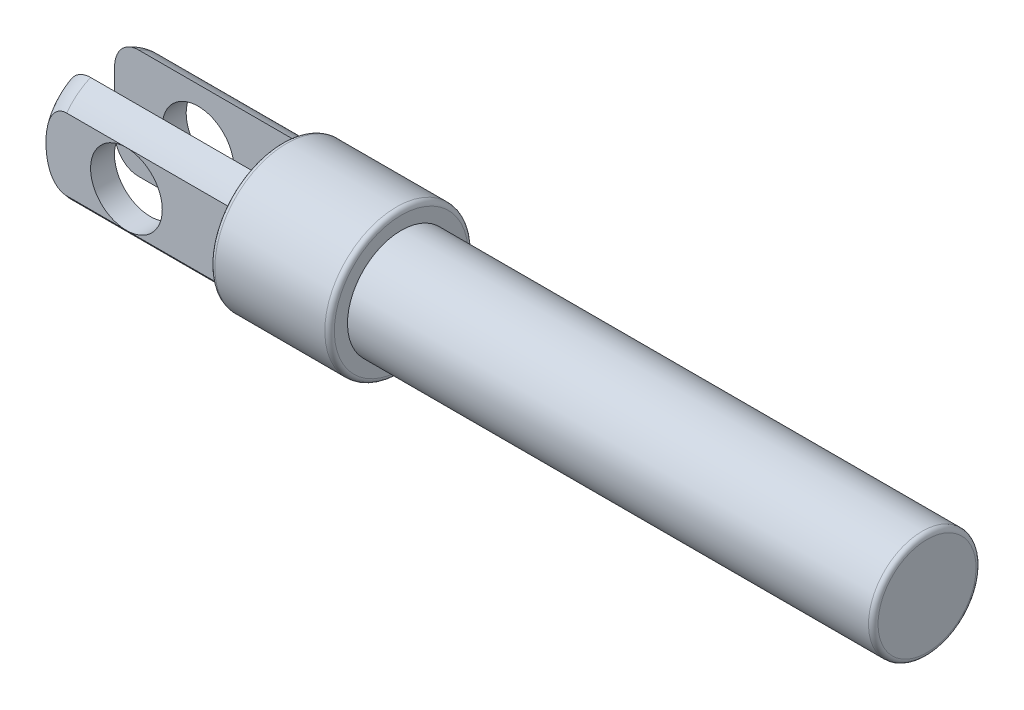
from build123d import *

# Parameters (mm, degrees)
FILLET_1_R               = 1
SKETCH_2_R               = 7.321356554
SKETCH_2_W               = 1
SKETCH_2_H               = 8.939101976
SKETCH_2_H_2             = 8.847887315
CUT_EXTRUDE_1_DEPTH      = 8
FILLET_2_R               = 0.2
CUT_EXTRUDE_2_DEPTH      = 36.355339178
CUT_EXTRUDE_2_DEPTH_BACK = 36.355339178
SKETCH_3_R               = 1.5


with BuildPart() as part:
    # 草图1 → 旋转1 (revolve)
    with BuildSketch(Plane.XY):
        Polygon((0, 0), (0, 2.25), (-22, 2.25), (-22, 3), (-27, 3), (-27, 2.5), (-35, 2.5), (-35, 0), align=None)
    revolve(axis=Axis((0, 0, 0), (-1, 0, 0)))

    # 圆角1
    fillet_1_edges = [part.edges().sort_by_distance(p)[0] for p in [
        (-35, -2.5, 0),
    ]]
    fillet(fillet_1_edges, radius=FILLET_1_R)

    # 草图2 → 切除-拉伸1 (cut)
    with BuildSketch(Plane.ZY.offset(35)):
        Circle(SKETCH_2_R)
        with Locations((-1.5, 0.70306053)):
            Rectangle(SKETCH_2_W, SKETCH_2_H, mode=Mode.SUBTRACT)
        with Locations((1.5, 0.129971064)):
            Rectangle(SKETCH_2_W, SKETCH_2_H_2, mode=Mode.SUBTRACT)
    extrude(amount=-CUT_EXTRUDE_1_DEPTH, mode=Mode.SUBTRACT)

    # 圆角2
    fillet_2_edges = [part.edges().sort_by_distance(p)[0] for p in [
        (-27, -3, 0),
        (-22, -3, 0),
        (0, -2.25, 0),
    ]]
    fillet(fillet_2_edges, radius=FILLET_2_R)

    # 草图3 → 切除-拉伸2 (cut, two sides: drawn at the far end of the back side and taken through both)
    with BuildSketch(Plane(origin=(0, 0, -1), x_dir=(-1, 0, 0), z_dir=(0, 0, -1)).offset(-CUT_EXTRUDE_2_DEPTH_BACK)):
        with Locations(Location((31.5, 0, 0), (0, 0, 270))):
            Circle(SKETCH_3_R)
    extrude(amount=CUT_EXTRUDE_2_DEPTH + CUT_EXTRUDE_2_DEPTH_BACK, mode=Mode.SUBTRACT)


solid = part.part
